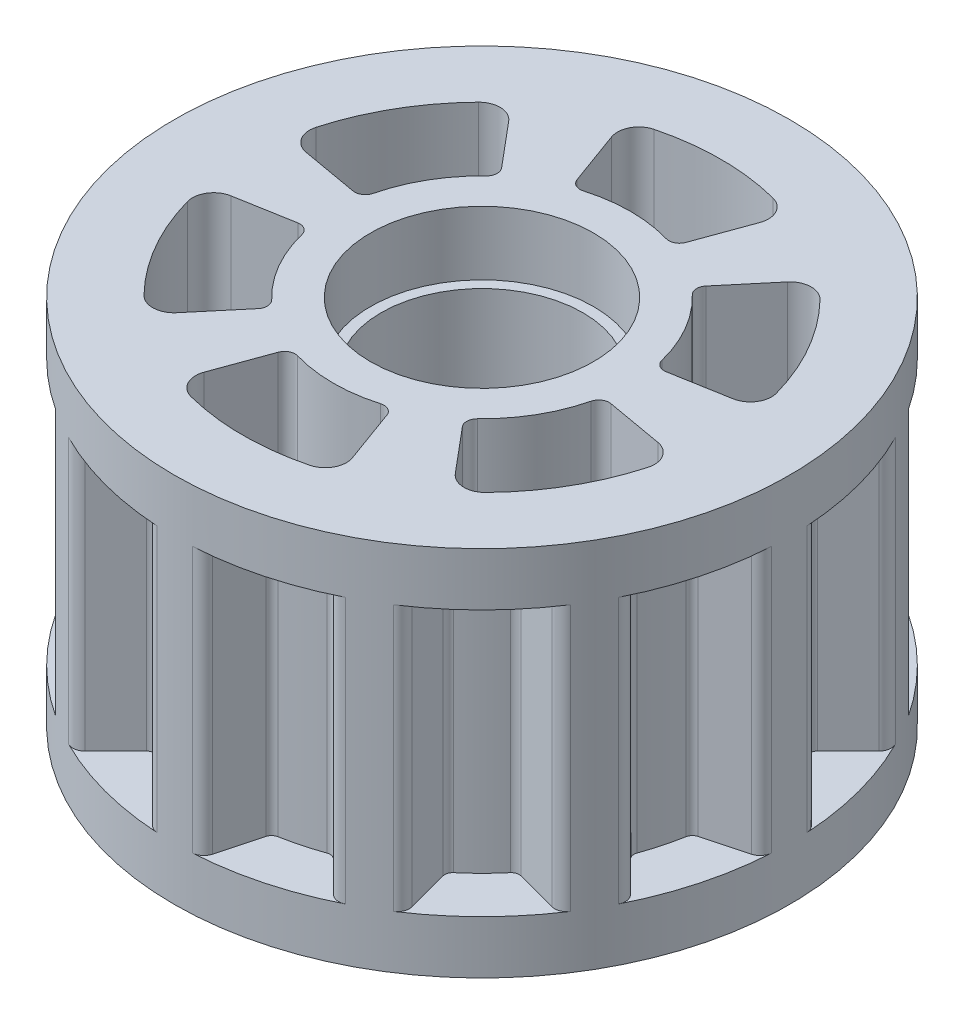
from build123d import *
from build123d.topology import SkipClean

# Parameters (mm, degrees)
SKETCH_1_R          = 57.955
EXTRUDE_1_DEPTH     = 10
EXTRUDE_2_DEPTH     = 50
SKETCH_4_R          = 57.955
EXTRUDE_3_DEPTH     = 10
SKETCH_5_R          = 21
CUT_EXTRUDE_1_DEPTH = 12
SKETCH_6_R          = 19
CUT_EXTRUDE_2_DEPTH = 46
SKETCH_7_R          = 21
CUT_EXTRUDE_3_DEPTH = 101.406992037
CUT_EXTRUDE_4_DEPTH = 108.784804356


with BuildPart() as part:
    # 草图1 → 凸台-拉伸1 (new body)
    with BuildSketch(Plane(origin=(0, 0, 0), x_dir=(1, 0, 0), z_dir=(0, 1, 0))):
        with Locations(Location((0, 0, 0), (0, 0, 270))):
            Circle(SKETCH_1_R)
    extrude(amount=EXTRUDE_1_DEPTH)

    # 草图2 → 凸台-拉伸2 (add)
    with SkipClean():  # the faces are left unmerged after this step: merging them gives an invalid solid
        with BuildSketch(Plane(origin=(0, 10, 0), x_dir=(1, 0, 0), z_dir=(0, 1, 0))):
            with BuildLine():
                Line((5.418541194, 56.160561005), (7.549299954, 48.23991877))
                ThreePointArc((7.549299954, 48.23991877), (7.980314371, 47.527443053), (8.724893825, 47.154620693))
                ThreePointArc((8.724893825, 47.154620693), (10.576497353, 46.774135254), (12.411667308, 46.320973))
                ThreePointArc((12.411667308, 46.320973), (14.227552236, 45.795838046), (16.021330649, 45.199546339))
                ThreePointArc((16.021330649, 45.199546339), (16.852566551, 45.150130247), (17.582073844, 45.551645109))
                Line((17.582073844, 45.551645109), (23.387686177, 51.345743118))
                ThreePointArc((23.387686177, 51.345743118), (24.647925524, 51.988719056), (26.046080388, 51.772422402))
                ThreePointArc((26.046080388, 51.772422402), (28.9775, 50.190502276), (31.813192822, 48.442778487))
                ThreePointArc((31.813192822, 48.442778487), (32.69958865, 47.340089182), (32.772874828, 45.927201924))
                Line((32.772874828, 45.927201924), (30.657844926, 38.002345155))
                ThreePointArc((30.657844926, 38.002345155), (30.674876502, 37.169815875), (31.133290045, 36.474652514))
                ThreePointArc((31.133290045, 36.474652514), (32.546583017, 35.219340694), (33.909305692, 33.909305692))
                ThreePointArc((33.909305692, 33.909305692), (35.219340694, 32.546583017), (36.474652514, 31.133290045))
                ThreePointArc((36.474652514, 31.133290045), (37.169815875, 30.674876502), (38.002345155, 30.657844926))
                Line((38.002345155, 30.657844926), (45.927201924, 32.772874828))
                ThreePointArc((45.927201924, 32.772874828), (47.340089182, 32.69958865), (48.442778487, 31.813192822))
                ThreePointArc((48.442778487, 31.813192822), (50.190502276, 28.9775), (51.772422402, 26.046080388))
                ThreePointArc((51.772422402, 26.046080388), (51.988719056, 24.647925524), (51.345743118, 23.387686177))
                Line((51.345743118, 23.387686177), (45.551645109, 17.582073844))
                ThreePointArc((45.551645109, 17.582073844), (45.150130247, 16.852566551), (45.199546339, 16.021330649))
                ThreePointArc((45.199546339, 16.021330649), (45.795838046, 14.227552236), (46.320973, 12.411667308))
                ThreePointArc((46.320973, 12.411667308), (46.774135254, 10.576497353), (47.154620693, 8.724893825))
                ThreePointArc((47.154620693, 8.724893825), (47.527443053, 7.980314371), (48.23991877, 7.549299954))
                Line((48.23991877, 7.549299954), (56.160561005, 5.418541194))
                ThreePointArc((56.160561005, 5.418541194), (57.347514174, 4.648629874), (57.85927321, 3.329643916))
                ThreePointArc((57.85927321, 3.329643916), (57.955, 0), (57.85927321, -3.329643916))
                ThreePointArc((57.85927321, -3.329643916), (57.347514174, -4.648629874), (56.160561005, -5.418541194))
                Line((56.160561005, -5.418541194), (48.23991877, -7.549299954))
                ThreePointArc((48.23991877, -7.549299954), (47.527443053, -7.980314371), (47.154620693, -8.724893825))
                ThreePointArc((47.154620693, -8.724893825), (46.774135254, -10.576497353), (46.320973, -12.411667308))
                ThreePointArc((46.320973, -12.411667308), (45.795838046, -14.227552236), (45.199546339, -16.021330649))
                ThreePointArc((45.199546339, -16.021330649), (45.150130247, -16.852566551), (45.551645109, -17.582073844))
                Line((45.551645109, -17.582073844), (51.345743118, -23.387686177))
                ThreePointArc((51.345743118, -23.387686177), (51.988719056, -24.647925524), (51.772422402, -26.046080388))
                ThreePointArc((51.772422402, -26.046080388), (50.190502276, -28.9775), (48.442778487, -31.813192822))
                ThreePointArc((48.442778487, -31.813192822), (47.340089182, -32.69958865), (45.927201924, -32.772874828))
                Line((45.927201924, -32.772874828), (38.002345155, -30.657844926))
                ThreePointArc((38.002345155, -30.657844926), (37.169815875, -30.674876502), (36.474652514, -31.133290045))
                ThreePointArc((36.474652514, -31.133290045), (35.219340694, -32.546583017), (33.909305692, -33.909305692))
                ThreePointArc((33.909305692, -33.909305692), (32.546583017, -35.219340694), (31.133290045, -36.474652514))
                ThreePointArc((31.133290045, -36.474652514), (30.674876502, -37.169815875), (30.657844926, -38.002345155))
                Line((30.657844926, -38.002345155), (32.772874828, -45.927201924))
                ThreePointArc((32.772874828, -45.927201924), (32.69958865, -47.340089182), (31.813192822, -48.442778487))
                ThreePointArc((31.813192822, -48.442778487), (28.9775, -50.190502276), (26.046080388, -51.772422402))
                ThreePointArc((26.046080388, -51.772422402), (24.647925524, -51.988719056), (23.387686177, -51.345743118))
                Line((23.387686177, -51.345743118), (17.582073844, -45.551645109))
                ThreePointArc((17.582073844, -45.551645109), (16.852566551, -45.150130247), (16.021330649, -45.199546339))
                ThreePointArc((16.021330649, -45.199546339), (14.227552236, -45.795838046), (12.411667308, -46.320973))
                ThreePointArc((12.411667308, -46.320973), (10.576497353, -46.774135254), (8.724893825, -47.154620693))
                ThreePointArc((8.724893825, -47.154620693), (7.980314371, -47.527443053), (7.549299954, -48.23991877))
                Line((7.549299954, -48.23991877), (5.418541194, -56.160561005))
                ThreePointArc((5.418541194, -56.160561005), (4.648629874, -57.347514174), (3.329643916, -57.85927321))
                ThreePointArc((3.329643916, -57.85927321), (0, -57.955), (-3.329643916, -57.85927321))
                ThreePointArc((-3.329643916, -57.85927321), (-4.648629874, -57.347514174), (-5.418541194, -56.160561005))
                Line((-5.418541194, -56.160561005), (-7.549299954, -48.23991877))
                ThreePointArc((-7.549299954, -48.23991877), (-7.980314371, -47.527443053), (-8.724893825, -47.154620693))
                ThreePointArc((-8.724893825, -47.154620693), (-10.576497353, -46.774135254), (-12.411667308, -46.320973))
                ThreePointArc((-12.411667308, -46.320973), (-14.227552236, -45.795838046), (-16.021330649, -45.199546339))
                ThreePointArc((-16.021330649, -45.199546339), (-16.852566551, -45.150130247), (-17.582073844, -45.551645109))
                Line((-17.582073844, -45.551645109), (-23.387686177, -51.345743118))
                ThreePointArc((-23.387686177, -51.345743118), (-24.647925524, -51.988719056), (-26.046080388, -51.772422402))
                ThreePointArc((-26.046080388, -51.772422402), (-28.9775, -50.190502276), (-31.813192822, -48.442778487))
                ThreePointArc((-31.813192822, -48.442778487), (-32.69958865, -47.340089182), (-32.772874828, -45.927201924))
                Line((-32.772874828, -45.927201924), (-30.657844926, -38.002345155))
                ThreePointArc((-30.657844926, -38.002345155), (-30.674876502, -37.169815875), (-31.133290045, -36.474652514))
                ThreePointArc((-31.133290045, -36.474652514), (-32.546583017, -35.219340694), (-33.909305692, -33.909305692))
                ThreePointArc((-33.909305692, -33.909305692), (-35.219340694, -32.546583017), (-36.474652514, -31.133290045))
                ThreePointArc((-36.474652514, -31.133290045), (-37.169815875, -30.674876502), (-38.002345155, -30.657844926))
                Line((-38.002345155, -30.657844926), (-45.927201924, -32.772874828))
                ThreePointArc((-45.927201924, -32.772874828), (-47.340089182, -32.69958865), (-48.442778487, -31.813192822))
                ThreePointArc((-48.442778487, -31.813192822), (-50.190502276, -28.9775), (-51.772422402, -26.046080388))
                ThreePointArc((-51.772422402, -26.046080388), (-51.988719056, -24.647925524), (-51.345743118, -23.387686177))
                Line((-51.345743118, -23.387686177), (-45.551645109, -17.582073844))
                ThreePointArc((-45.551645109, -17.582073844), (-45.150130247, -16.852566551), (-45.199546339, -16.021330649))
                ThreePointArc((-45.199546339, -16.021330649), (-45.795838046, -14.227552236), (-46.320973, -12.411667308))
                ThreePointArc((-46.320973, -12.411667308), (-46.774135254, -10.576497353), (-47.154620693, -8.724893825))
                ThreePointArc((-47.154620693, -8.724893825), (-47.527443053, -7.980314371), (-48.23991877, -7.549299954))
                Line((-48.23991877, -7.549299954), (-56.160561005, -5.418541194))
                ThreePointArc((-56.160561005, -5.418541194), (-57.347514174, -4.648629874), (-57.85927321, -3.329643916))
                ThreePointArc((-57.85927321, -3.329643916), (-57.955, 0), (-57.85927321, 3.329643916))
                ThreePointArc((-57.85927321, 3.329643916), (-57.347514174, 4.648629874), (-56.160561005, 5.418541194))
                Line((-56.160561005, 5.418541194), (-48.23991877, 7.549299954))
                ThreePointArc((-48.23991877, 7.549299954), (-47.527443053, 7.980314371), (-47.154620693, 8.724893825))
                ThreePointArc((-47.154620693, 8.724893825), (-46.774135254, 10.576497353), (-46.320973, 12.411667308))
                ThreePointArc((-46.320973, 12.411667308), (-45.795838046, 14.227552236), (-45.199546339, 16.021330649))
                ThreePointArc((-45.199546339, 16.021330649), (-45.150130247, 16.852566551), (-45.551645109, 17.582073844))
                Line((-45.551645109, 17.582073844), (-51.345743118, 23.387686177))
                ThreePointArc((-51.345743118, 23.387686177), (-51.988719056, 24.647925524), (-51.772422402, 26.046080388))
                ThreePointArc((-51.772422402, 26.046080388), (-50.190502276, 28.9775), (-48.442778487, 31.813192822))
                ThreePointArc((-48.442778487, 31.813192822), (-47.340089182, 32.69958865), (-45.927201924, 32.772874828))
                Line((-45.927201924, 32.772874828), (-38.002345155, 30.657844926))
                ThreePointArc((-38.002345155, 30.657844926), (-37.169815875, 30.674876502), (-36.474652514, 31.133290045))
                ThreePointArc((-36.474652514, 31.133290045), (-35.219340694, 32.546583017), (-33.909305692, 33.909305692))
                ThreePointArc((-33.909305692, 33.909305692), (-32.546583017, 35.219340694), (-31.133290045, 36.474652514))
                ThreePointArc((-31.133290045, 36.474652514), (-30.674876502, 37.169815875), (-30.657844926, 38.002345155))
                Line((-30.657844926, 38.002345155), (-32.772874828, 45.927201924))
                ThreePointArc((-32.772874828, 45.927201924), (-32.69958865, 47.340089182), (-31.813192822, 48.442778487))
                ThreePointArc((-31.813192822, 48.442778487), (-28.9775, 50.190502276), (-26.046080388, 51.772422402))
                ThreePointArc((-26.046080388, 51.772422402), (-24.647925524, 51.988719056), (-23.387686177, 51.345743118))
                Line((-23.387686177, 51.345743118), (-17.582073844, 45.551645109))
                ThreePointArc((-17.582073844, 45.551645109), (-16.852566551, 45.150130247), (-16.021330649, 45.199546339))
                ThreePointArc((-16.021330649, 45.199546339), (-14.227552236, 45.795838046), (-12.411667308, 46.320973))
                ThreePointArc((-12.411667308, 46.320973), (-10.576497353, 46.774135254), (-8.724893825, 47.154620693))
                ThreePointArc((-8.724893825, 47.154620693), (-7.980314371, 47.527443053), (-7.549299954, 48.23991877))
                Line((-7.549299954, 48.23991877), (-5.418541194, 56.160561005))
                ThreePointArc((-5.418541194, 56.160561005), (-4.648629874, 57.347514174), (-3.329643916, 57.85927321))
                ThreePointArc((-3.329643916, 57.85927321), (0, 57.955), (3.329643916, 57.85927321))
                ThreePointArc((3.329643916, 57.85927321), (4.648629874, 57.347514174), (5.418541194, 56.160561005))
            make_face()
        extrude(amount=EXTRUDE_2_DEPTH)

    # 草图4 → 凸台-拉伸3 (add)
    with SkipClean():  # the faces are left unmerged after this step: merging them gives an invalid solid
        with BuildSketch(Plane(origin=(0, 60, 0), x_dir=(1, 0, 0), z_dir=(0, 1, 0))):
            with Locations(Location((0, 0, 0), (0, 0, 270))):
                Circle(SKETCH_4_R)
        extrude(amount=EXTRUDE_3_DEPTH)

    # 草图5 → 切除-拉伸1 (cut)
    with SkipClean():  # the faces are left unmerged after this step: merging them gives an invalid solid
        with BuildSketch(Plane(origin=(0, 0, 0), x_dir=(1, 0, 0), z_dir=(0, 1, 0))):
            with Locations(Location((0, 0, 0), (0, 0, 270))):
                Circle(SKETCH_5_R)
        extrude(amount=CUT_EXTRUDE_1_DEPTH, mode=Mode.SUBTRACT)

    # 草图6 → 切除-拉伸2 (cut)
    with SkipClean():  # the faces are left unmerged after this step: merging them gives an invalid solid
        with BuildSketch(Plane(origin=(0, 12, 0), x_dir=(-1, 0, 0), z_dir=(0, -1, 0))):
            with Locations(Location((0, 0, 0), (0, 0, 90))):
                Circle(SKETCH_6_R)
        extrude(amount=-CUT_EXTRUDE_2_DEPTH, mode=Mode.SUBTRACT)

    # 草图7 → 切除-拉伸3 (cut, through all)
    with SkipClean():  # the faces are left unmerged after this step: merging them gives an invalid solid
        with BuildSketch(Plane(origin=(0, 58, 0), x_dir=(-1, 0, 0), z_dir=(0, -1, 0))):
            with Locations(Location((0, 0, 0), (0, 0, 270))):
                Circle(SKETCH_7_R)
        extrude(amount=-CUT_EXTRUDE_3_DEPTH, mode=Mode.SUBTRACT)

    # 草图8 → 切除-拉伸4 (cut, through all)
    with SkipClean():  # the faces are left unmerged after this step: merging them gives an invalid solid
        with BuildSketch(Plane(origin=(0, 0, 0), x_dir=(1, 0, 0), z_dir=(0, 1, 0))):
            with BuildLine():
                Line((10.237777566, 28.128062687), (13.955930679, 38.343604407))
                ThreePointArc((13.955930679, 38.343604407), (13.735504644, 41.577192568), (11.192005092, 43.58599571))
                ThreePointArc((11.192005092, 43.58599571), (0, 45), (-11.192005092, 43.58599571))
                ThreePointArc((-11.192005092, 43.58599571), (-13.735504644, 41.577192568), (-13.955930679, 38.343604407))
                Line((-13.955930679, 38.343604407), (-10.237777566, 28.128062687))
                ThreePointArc((-10.237777566, 28.128062687), (-9.263612769, 27.028686044), (-7.801166169, 26.891296109))
                ThreePointArc((-7.801166169, 26.891296109), (0, 28), (7.801166169, 26.891296109))
                ThreePointArc((7.801166169, 26.891296109), (9.263612769, 27.028686044), (10.237777566, 28.128062687))
            make_face()
            with BuildLine():
                Line((29.478505629, 5.197855893), (40.184500828, 7.085611702))
                ThreePointArc((40.184500828, 7.085611702), (42.874657304, 8.893300328), (43.34258208, 12.100437126))
                ThreePointArc((43.34258208, 12.100437126), (38.97114317, 22.5), (32.150576988, 31.485558584))
                ThreePointArc((32.150576988, 31.485558584), (29.13915266, 32.68389224), (26.22857015, 31.257992704))
                Line((26.22857015, 31.257992704), (19.240728063, 22.930206794))
                ThreePointArc((19.240728063, 22.930206794), (18.77572236, 21.536867011), (19.387962486, 20.201656136))
                ThreePointArc((19.387962486, 20.201656136), (24.248711306, 14), (27.189128655, 6.689639973))
                ThreePointArc((27.189128655, 6.689639973), (28.03933513, 5.491819033), (29.478505629, 5.197855893))
            make_face()
            with BuildLine():
                Line((19.240728063, -22.930206794), (26.22857015, -31.257992704))
                ThreePointArc((26.22857015, -31.257992704), (29.13915266, -32.68389224), (32.150576988, -31.485558584))
                ThreePointArc((32.150576988, -31.485558584), (38.97114317, -22.5), (43.34258208, -12.100437126))
                ThreePointArc((43.34258208, -12.100437126), (42.874657304, -8.893300328), (40.184500828, -7.085611702))
                Line((40.184500828, -7.085611702), (29.478505629, -5.197855893))
                ThreePointArc((29.478505629, -5.197855893), (28.03933513, -5.491819033), (27.189128655, -6.689639973))
                ThreePointArc((27.189128655, -6.689639973), (24.248711306, -14), (19.387962486, -20.201656136))
                ThreePointArc((19.387962486, -20.201656136), (18.77572236, -21.536867011), (19.240728063, -22.930206794))
            make_face()
            with BuildLine():
                Line((-10.237777566, -28.128062687), (-13.955930679, -38.343604407))
                ThreePointArc((-13.955930679, -38.343604407), (-13.735504644, -41.577192568), (-11.192005092, -43.58599571))
                ThreePointArc((-11.192005092, -43.58599571), (0, -45), (11.192005092, -43.58599571))
                ThreePointArc((11.192005092, -43.58599571), (13.735504644, -41.577192568), (13.955930679, -38.343604407))
                Line((13.955930679, -38.343604407), (10.237777566, -28.128062687))
                ThreePointArc((10.237777566, -28.128062687), (9.263612769, -27.028686044), (7.801166169, -26.891296109))
                ThreePointArc((7.801166169, -26.891296109), (0, -28), (-7.801166169, -26.891296109))
                ThreePointArc((-7.801166169, -26.891296109), (-9.263612769, -27.028686044), (-10.237777566, -28.128062687))
            make_face()
            with BuildLine():
                Line((-29.478505629, -5.197855893), (-40.184500828, -7.085611702))
                ThreePointArc((-40.184500828, -7.085611702), (-42.874657304, -8.893300328), (-43.34258208, -12.100437126))
                ThreePointArc((-43.34258208, -12.100437126), (-38.97114317, -22.5), (-32.150576988, -31.485558584))
                ThreePointArc((-32.150576988, -31.485558584), (-29.13915266, -32.68389224), (-26.22857015, -31.257992704))
                Line((-26.22857015, -31.257992704), (-19.240728063, -22.930206794))
                ThreePointArc((-19.240728063, -22.930206794), (-18.77572236, -21.536867011), (-19.387962486, -20.201656136))
                ThreePointArc((-19.387962486, -20.201656136), (-24.248711306, -14), (-27.189128655, -6.689639973))
                ThreePointArc((-27.189128655, -6.689639973), (-28.03933513, -5.491819033), (-29.478505629, -5.197855893))
            make_face()
            with BuildLine():
                Line((-19.240728063, 22.930206794), (-26.22857015, 31.257992704))
                ThreePointArc((-26.22857015, 31.257992704), (-29.13915266, 32.68389224), (-32.150576988, 31.485558584))
                ThreePointArc((-32.150576988, 31.485558584), (-38.97114317, 22.5), (-43.34258208, 12.100437126))
                ThreePointArc((-43.34258208, 12.100437126), (-42.874657304, 8.893300328), (-40.184500828, 7.085611702))
                Line((-40.184500828, 7.085611702), (-29.478505629, 5.197855893))
                ThreePointArc((-29.478505629, 5.197855893), (-28.03933513, 5.491819033), (-27.189128655, 6.689639973))
                ThreePointArc((-27.189128655, 6.689639973), (-24.248711306, 14), (-19.387962486, 20.201656136))
                ThreePointArc((-19.387962486, 20.201656136), (-18.77572236, 21.536867011), (-19.240728063, 22.930206794))
            make_face()
        extrude(amount=CUT_EXTRUDE_4_DEPTH, mode=Mode.SUBTRACT)


solid = part.part
